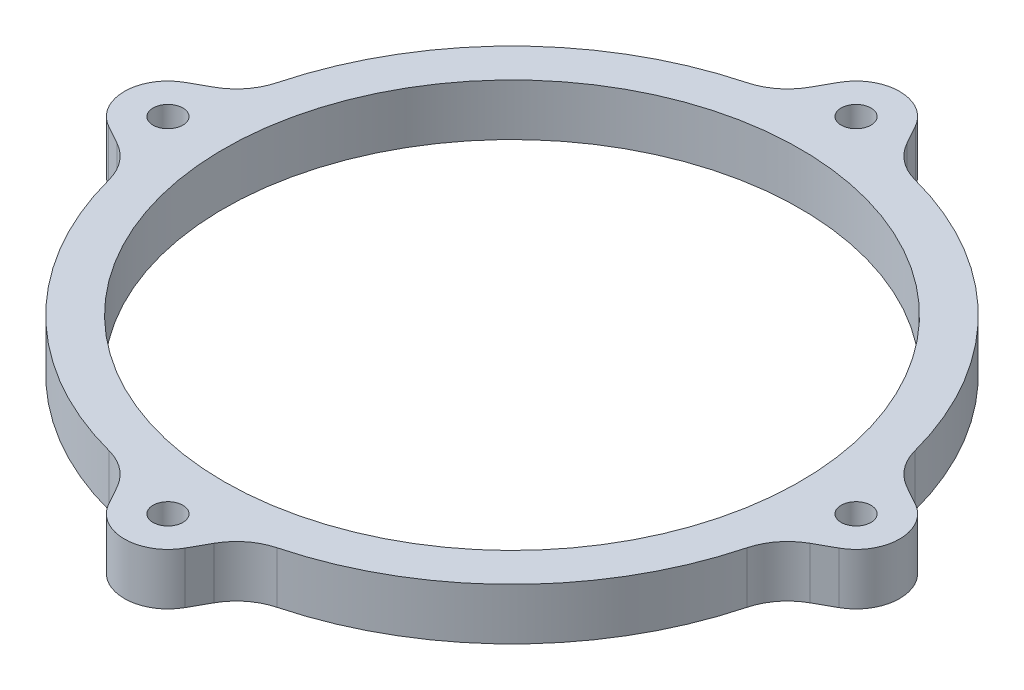
from build123d import *

# Parameters (mm, degrees)
SKETCH_1_R      = 50.25
SKETCH_1_R_2    = 2.6
EXTRUDE_1_DEPTH = 9
FILLET_1_R      = 10


with BuildPart() as part:
    # ｽｹｯﾁ1 → ﾎﾞｽ - 押し出し1 (new body)
    with BuildSketch(Plane(origin=(0, 0, 0), x_dir=(1, 0, 0), z_dir=(0, 1, 0))):
        with BuildLine():
            Line((-6.641105235, 63.695364835), (-10.641105235, 56.506786136))
            ThreePointArc((-10.641105235, 56.506786136), (-40.658639918, 40.658639918), (-56.506786136, 10.641105235))
            Line((-56.506786136, 10.641105235), (-63.695364835, 6.641105235))
            ThreePointArc((-63.695364835, 6.641105235), (-67.6, 0), (-63.695364835, -6.641105235))
            Line((-63.695364835, -6.641105235), (-56.506786136, -10.641105235))
            ThreePointArc((-56.506786136, -10.641105235), (-40.658639918, -40.658639918), (-10.641105235, -56.506786136))
            Line((-10.641105235, -56.506786136), (-6.641105235, -63.695364835))
            ThreePointArc((-6.641105235, -63.695364835), (0, -67.6), (6.641105235, -63.695364835))
            Line((6.641105235, -63.695364835), (10.641105235, -56.506786136))
            ThreePointArc((10.641105235, -56.506786136), (40.658639918, -40.658639918), (56.506786136, -10.641105235))
            Line((56.506786136, -10.641105235), (63.695364835, -6.641105235))
            ThreePointArc((63.695364835, -6.641105235), (67.6, 0), (63.695364835, 6.641105235))
            Line((63.695364835, 6.641105235), (56.506786136, 10.641105235))
            ThreePointArc((56.506786136, 10.641105235), (40.658639918, 40.658639918), (10.641105235, 56.506786136))
            Line((10.641105235, 56.506786136), (6.641105235, 63.695364835))
            ThreePointArc((6.641105235, 63.695364835), (0, 67.6), (-6.641105235, 63.695364835))
        make_face()
        with Locations(Location((0, 0, 0), (0, 0, 270))):
            Circle(SKETCH_1_R, mode=Mode.SUBTRACT)
        with Locations(Location((0, 60, 0), (0, 0, 270))):
            Circle(SKETCH_1_R_2, mode=Mode.SUBTRACT)
        with Locations(Location((60, 0, 0), (0, 0, 270))):
            Circle(SKETCH_1_R_2, mode=Mode.SUBTRACT)
        with Locations(Location((0, -60, 0), (0, 0, 270))):
            Circle(SKETCH_1_R_2, mode=Mode.SUBTRACT)
        with Locations(Location((-60, 0, 0), (0, 0, 270))):
            Circle(SKETCH_1_R_2, mode=Mode.SUBTRACT)
    extrude(amount=EXTRUDE_1_DEPTH)

    # ﾌｨﾚｯﾄ1
    fillet_1_edges = [part.edges().sort_by_distance(p)[0] for p in [
        (10.641105235, 4.5, -56.506786136),
        (56.506786136, 4.5, -10.641105235),
        (56.506786136, 4.5, 10.641105235),
        (10.641105235, 4.5, 56.506786136),
        (-10.641105235, 4.5, 56.506786136),
        (-56.506786136, 4.5, 10.641105235),
        (-56.506786136, 4.5, -10.641105235),
        (-10.641105235, 4.5, -56.506786136),
    ]]
    fillet(fillet_1_edges, radius=FILLET_1_R)


solid = part.part
